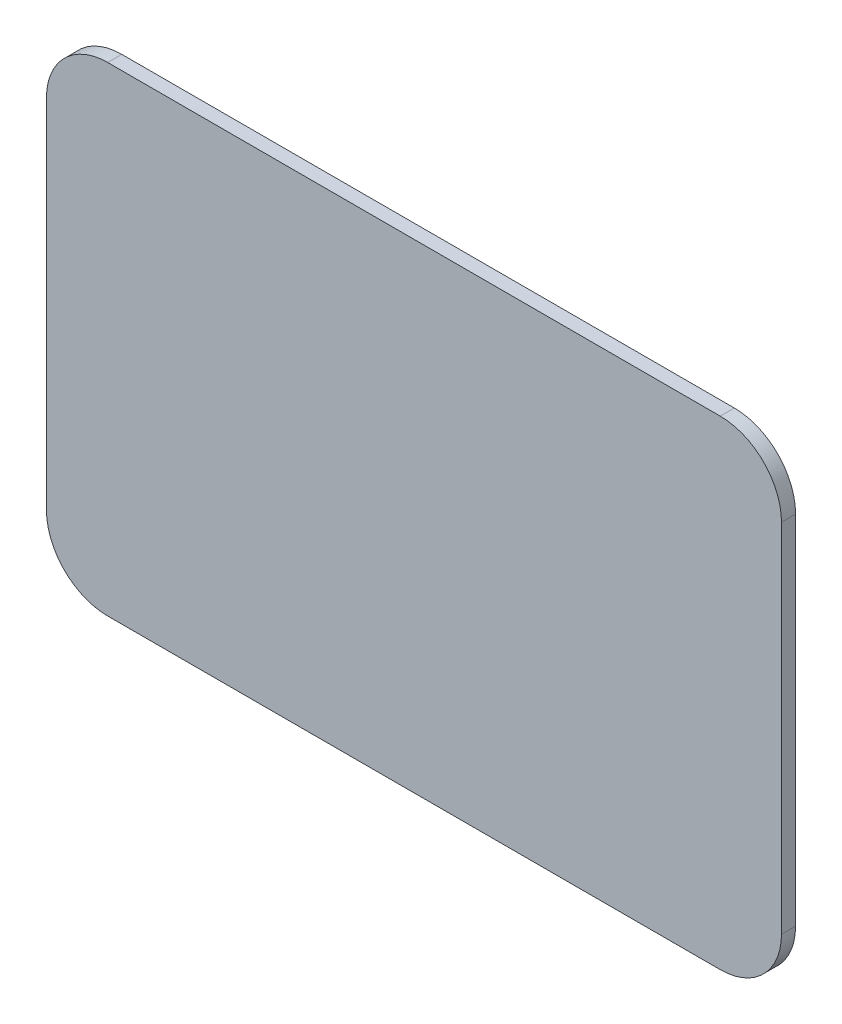
from build123d import *

# Parameters (mm, degrees)
BOSS_EXTRUDE1_DEPTH      = 1.5
BOSS_EXTRUDE1_DEPTH_BACK = 10


with BuildPart() as part:
    # Sketch1 → Boss-Extrude1 (new, two sides: drawn at the far end of the back side and taken through both)
    with BuildSketch(Plane.XY.offset(-BOSS_EXTRUDE1_DEPTH_BACK)):
        with BuildLine():
            Line((250, 195.65), (-250, 195.65))
            ThreePointArc((-250, 195.65), (-285.355339059, 181.005339059), (-300, 145.65))
            Line((-300, 145.65), (-300, -145.65))
            ThreePointArc((-300, -145.65), (-285.355339059, -181.005339059), (-250, -195.65))
            Line((-250, -195.65), (250, -195.65))
            ThreePointArc((250, -195.65), (285.355339059, -181.005339059), (300, -145.65))
            Line((300, -145.65), (300, 145.65))
            ThreePointArc((300, 145.65), (285.355339059, 181.005339059), (250, 195.65))
        make_face()
    extrude(amount=BOSS_EXTRUDE1_DEPTH + BOSS_EXTRUDE1_DEPTH_BACK)


solid = part.part
